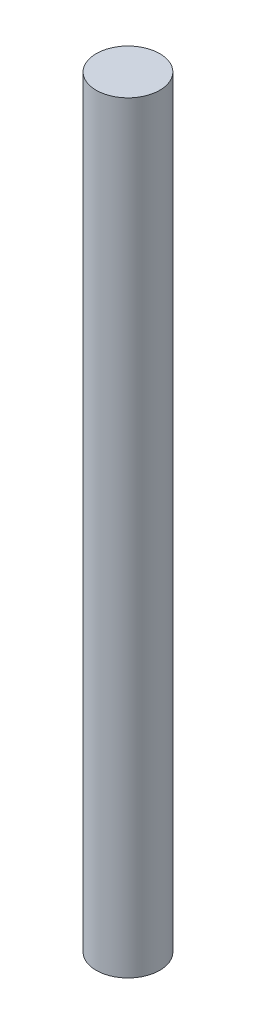
from build123d import *

# Parameters (mm, degrees)
ESQUISSE1_R        = 2.5
BOSS_EXTRU_1_DEPTH = 60


with BuildPart() as part:
    # Esquisse1 → Boss.-Extru.1 (new body)
    with BuildSketch(Plane(origin=(0, 0, 0), x_dir=(1, 0, 0), z_dir=(0, 1, 0))):
        with Locations(Location((0, 0, 0), (0, 0, 270))):
            Circle(ESQUISSE1_R)
    extrude(amount=BOSS_EXTRU_1_DEPTH)


solid = part.part
